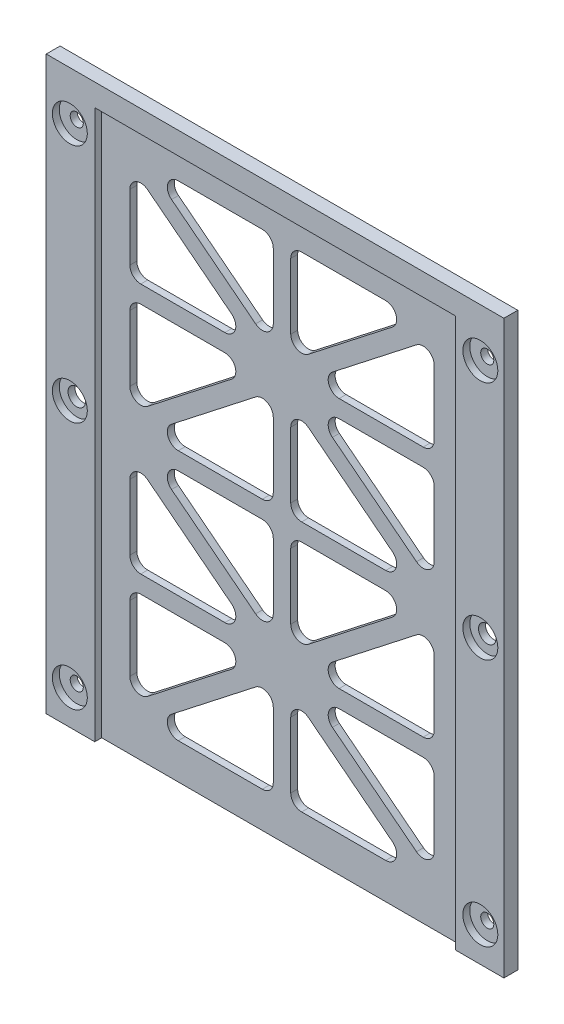
from build123d import *

# Parameters (mm, degrees)
SKETCH1_W                   = 104.775
SKETCH1_H                   = 251.46
BOSS_EXTRUDE2_DEPTH         = 3.175
CUTOUT_FILLETS_R            = 5
SKETCH2_W                   = 22.225
SKETCH2_H                   = 251.46
SKETCH2_R                   = 8
BOSS_EXTRUDE3_DEPTH         = 3.175
SKETCH3_R                   = 3
SKETCH3_R_2                 = 4
CUT_EXTRUDE1_DEPTH          = 30
CUTOUT_FILLETS_OF_MIRROR2_R = 5
SKETCH4_W                   = 209.55
SKETCH4_H                   = 6.35
BOSS_EXTRUDE4_DEPTH         = 10.16


with BuildPart() as part:
    # Sketch1 → Boss-Extrude2 (new body)
    with BuildSketch(Plane.XY):
        with Locations((52.3875, -8.189050142)):
            Rectangle(SKETCH1_W, SKETCH1_H)
        Polygon((4, 104.466937315), (4, 59.163810249), (62.035275472, 104.466937315), align=None, mode=Mode.SUBTRACT)
        Polygon((69.66, 100.270064381), (11.624724528, 54.966937315), (69.66, 54.966937315), align=None, mode=Mode.SUBTRACT)
        Polygon((11.624724528, 46.966937315), (69.66, 46.966937315), (69.66, 1.663810249), align=None, mode=Mode.SUBTRACT)
        Polygon((62.035275472, -2.533062685), (4, 42.770064381), (4, -2.533062685), align=None, mode=Mode.SUBTRACT)
        Polygon((4, -10.533062685), (62.035275472, -10.533062685), (4, -55.836189751), align=None, mode=Mode.SUBTRACT)
        Polygon((69.66, -14.729935619), (11.624724528, -60.033062685), (69.66, -60.033062685), align=None, mode=Mode.SUBTRACT)
        Polygon((11.624724528, -68.033062685), (69.66, -68.033062685), (69.66, -113.336189751), align=None, mode=Mode.SUBTRACT)
        Polygon((4, -117.533062685), (4, -72.229935619), (62.035275472, -117.533062685), align=None, mode=Mode.SUBTRACT)
    boss_extrude2 = extrude(amount=BOSS_EXTRUDE2_DEPTH)

    # Cutout_Fillets
    cutout_fillets_edges = [part.edges().sort_by_distance(p)[0] for p in [
        (62.035275472, 104.466937315, 1.5875),
        (4, 104.466937315, 1.5875),
        (4, 59.163810249, 1.5875),
        (69.66, 54.966937315, 1.5875),
        (69.66, 100.270064381, 1.5875),
        (11.624724528, 54.966937315, 1.5875),
        (11.624724528, 46.966937315, 1.5875),
        (69.66, 1.663810249, 1.5875),
        (69.66, 46.966937315, 1.5875),
        (4, -2.533062685, 1.5875),
        (62.035275472, -2.533062685, 1.5875),
        (4, 42.770064381, 1.5875),
        (4, -10.533062685, 1.5875),
        (4, -55.836189751, 1.5875),
        (62.035275472, -10.533062685, 1.5875),
        (69.66, -60.033062685, 1.5875),
        (69.66, -14.729935619, 1.5875),
        (11.624724528, -60.033062685, 1.5875),
        (11.624724528, -68.033062685, 1.5875),
        (69.66, -113.336189751, 1.5875),
        (69.66, -68.033062685, 1.5875),
        (4, -117.533062685, 1.5875),
        (62.035275472, -117.533062685, 1.5875),
        (4, -72.229935619, 1.5875),
    ]]
    fillet(cutout_fillets_edges, radius=CUTOUT_FILLETS_R)

    # Sketch2 → Boss-Extrude3 (add)
    with BuildSketch(Plane.XY.offset(3.175)):
        with Locations((93.6625, -8.189050142)):
            Rectangle(SKETCH2_W, SKETCH2_H)
        with Locations(Location((93.98, -118.115286613, 0), (0, 0, 180))):
            Circle(SKETCH2_R, mode=Mode.SUBTRACT)
        with Locations(Location((93.98, -4.379050142, 0), (0, 0, 180))):
            Circle(SKETCH2_R, mode=Mode.SUBTRACT)
        with Locations(Location((93.98, 105.540949858, 0), (0, 0, 180))):
            Circle(SKETCH2_R, mode=Mode.SUBTRACT)
    boss_extrude3 = extrude(amount=BOSS_EXTRUDE3_DEPTH)

    # Sketch3 → Cut-Extrude1 (cut)
    with BuildSketch(Plane.XY.offset(6.35)):
        with Locations((93.98, 105.540949858)):
            Circle(SKETCH3_R)
        with Locations((93.98, -4.379050142)):
            Circle(SKETCH3_R_2)
        with Locations((93.98, -118.115286613)):
            Circle(SKETCH3_R)
    cut_extrude1 = extrude(amount=-CUT_EXTRUDE1_DEPTH, mode=Mode.SUBTRACT)

    # Mirror2: Boss-Extrude2, Boss-Extrude3, Cut-Extrude1 across Right Plane
    add(boss_extrude2.mirror(Plane(origin=(0, 0, 0), x_dir=(0, 0, -1), z_dir=(1, 0, 0))))
    add(boss_extrude3.mirror(Plane(origin=(0, 0, 0), x_dir=(0, 0, -1), z_dir=(1, 0, 0))))
    add(cut_extrude1.mirror(Plane(origin=(0, 0, 0), x_dir=(0, 0, -1), z_dir=(1, 0, 0))), mode=Mode.SUBTRACT)

    # Cutout_Fillets of Mirror2
    cutout_fillets_of_mirror2_edges = [part.edges().sort_by_distance(p)[0] for p in [
        (-62.035275472, 104.466937315, 1.5875),
        (-4, 104.466937315, 1.5875),
        (-4, 59.163810249, 1.5875),
        (-69.66, 54.966937315, 1.5875),
        (-69.66, 100.270064381, 1.5875),
        (-11.624724528, 54.966937315, 1.5875),
        (-11.624724528, 46.966937315, 1.5875),
        (-69.66, 1.663810249, 1.5875),
        (-69.66, 46.966937315, 1.5875),
        (-4, -2.533062685, 1.5875),
        (-62.035275472, -2.533062685, 1.5875),
        (-4, 42.770064381, 1.5875),
        (-4, -10.533062685, 1.5875),
        (-4, -55.836189751, 1.5875),
        (-62.035275472, -10.533062685, 1.5875),
        (-69.66, -60.033062685, 1.5875),
        (-69.66, -14.729935619, 1.5875),
        (-11.624724528, -60.033062685, 1.5875),
        (-11.624724528, -68.033062685, 1.5875),
        (-69.66, -113.336189751, 1.5875),
        (-69.66, -68.033062685, 1.5875),
        (-4, -117.533062685, 1.5875),
        (-62.035275472, -117.533062685, 1.5875),
        (-4, -72.229935619, 1.5875),
    ]]
    fillet(cutout_fillets_of_mirror2_edges, radius=CUTOUT_FILLETS_OF_MIRROR2_R)

    # Sketch4 → Boss-Extrude4 (add)
    with BuildSketch(Plane(origin=(0, 117.540949858, 0), x_dir=(1, 0, 0), z_dir=(0, 1, 0))):
        with Locations((0, -3.175)):
            Rectangle(SKETCH4_W, SKETCH4_H)
    extrude(amount=BOSS_EXTRUDE4_DEPTH)


solid = part.part
